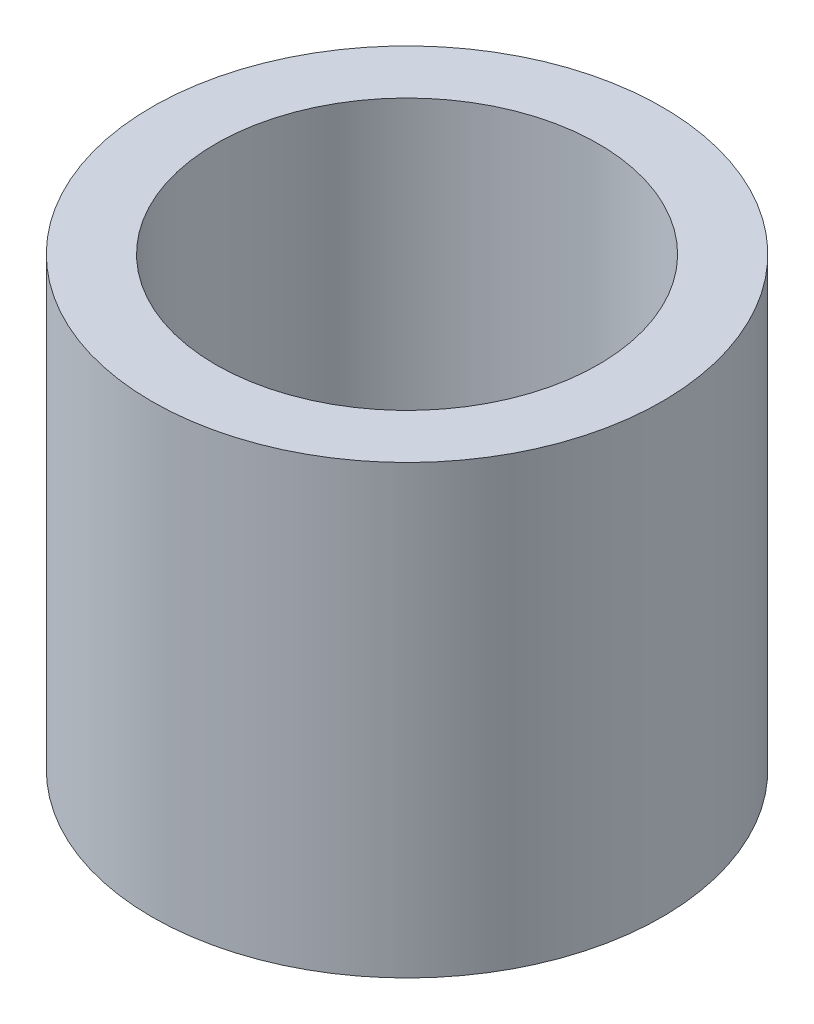
from build123d import *

# Parameters (mm, degrees)
SKETCH_1_R      = 4
SKETCH_1_R_2    = 3
EXTRUDE_1_DEPTH = 7


with BuildPart() as part:
    # 草图1 → 凸台-拉伸1 (new body)
    with BuildSketch(Plane(origin=(0, 0, 0), x_dir=(1, 0, 0), z_dir=(0, 1, 0))):
        with Locations(Location((0, 0, 0), (0, 0, 270))):
            Circle(SKETCH_1_R)
        with Locations(Location((0, 0, 0), (0, 0, 270))):
            Circle(SKETCH_1_R_2, mode=Mode.SUBTRACT)
    extrude(amount=EXTRUDE_1_DEPTH)


solid = part.part
